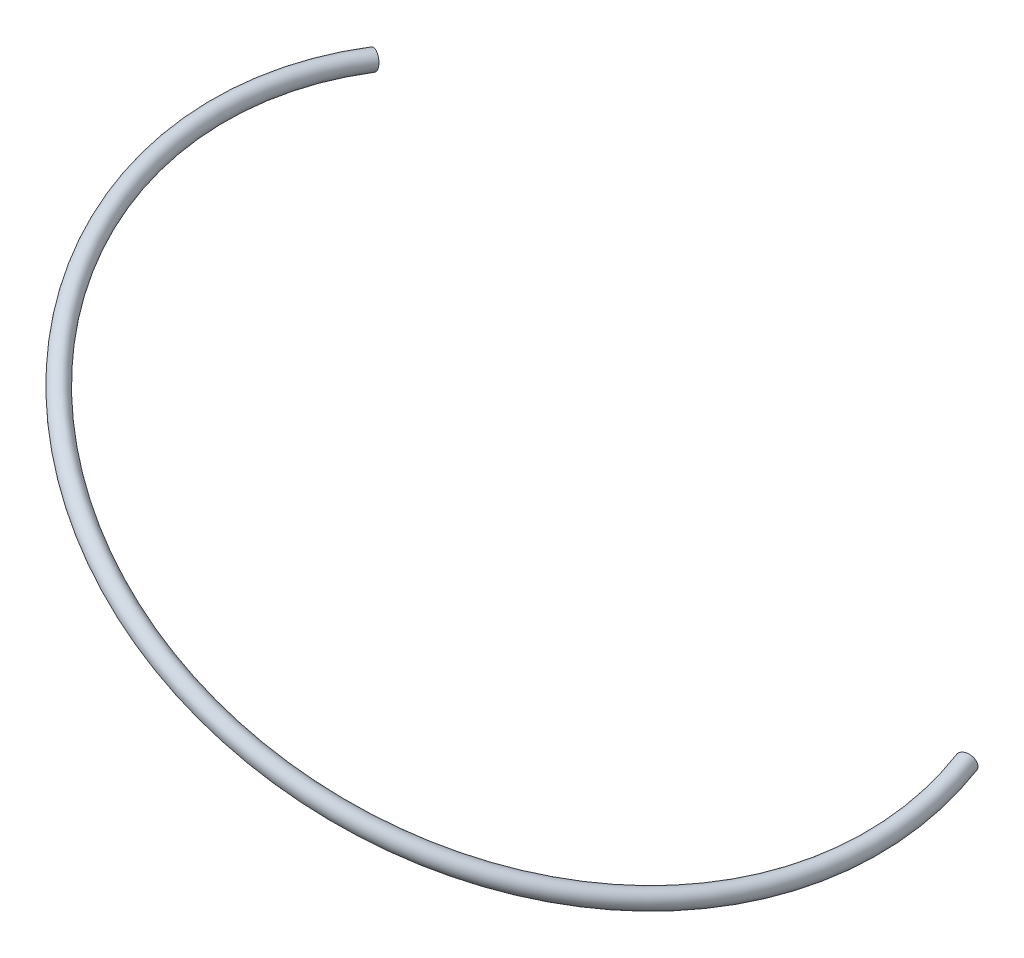
from build123d import *

# Parameters (mm, degrees)
SWEEP1_PROFILE_R = 2


with BuildPart() as part:
    # Sweep1: sweep along a path in Sketch2
    with BuildLine(Plane(origin=(29.094495803, 61.663978223, 0), x_dir=(0.9043879364804229, -0.426711214228877, 0), z_dir=(0.426711214228877, 0.9043879364804229, 0))) as sweep1_path:
        ThreePointArc((83.930248443, -22.25), (155.616082836, -130.957654098), (234.031764091, -27))
    # Sweep1 profile (on start of the path) → Sweep1 (sweep)
    with BuildSketch(Plane(origin=(105, 25.85, 22.25), x_dir=(0.942643233477194, 0, 0.33380193884946285), z_dir=(-0.3297374481014941, 0.15557777938048117, 0.9311652752774627))):
        Circle(SWEEP1_PROFILE_R)
    sweep(path=sweep1_path.line)


solid = part.part
